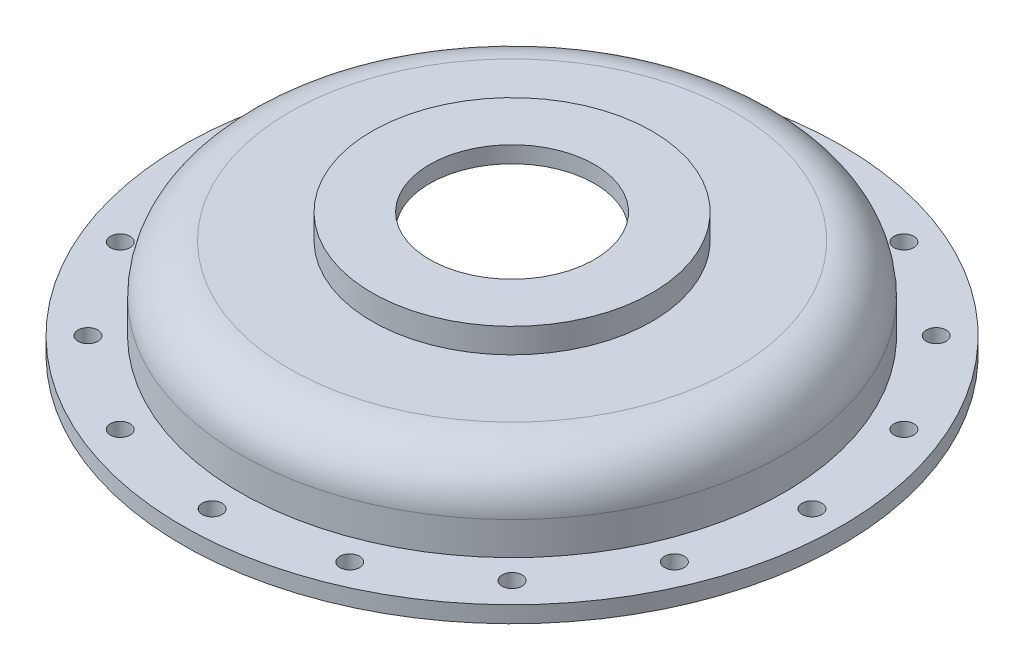
from build123d import *

# Parameters (mm, degrees)
SKETCH2_R          = 6
CUT_EXTRUDE8_DEPTH = 291.215437219
CIRPATTERN1_COUNT  = 16


with BuildPart() as part:
    # Sketch1 → Revolve2 (revolve)
    with BuildSketch(Plane.XY, mode=Mode.PRIVATE) as revolve2_sk:
        with BuildLine():
            Line((-200, 10), (-165, 10))
            Line((-165, 10), (-165, 30))
            ThreePointArc((-165, 30), (-156.213203436, 51.213203436), (-135, 60))
            Line((-135, 60), (-85, 60))
            Line((-85, 60), (-85, 75))
            Line((-85, 75), (-50, 75))
            Line((-50, 75), (-50, 65))
            Line((-50, 65), (-75, 65))
            Line((-75, 65), (-75, 50))
            Line((-75, 50), (-135, 50))
            ThreePointArc((-135, 50), (-149.142135624, 44.142135624), (-155, 30))
            Line((-155, 30), (-155, 0))
            Line((-155, 0), (-200, 0))
            Line((-200, 0), (-200, 10))
        make_face()
    revolve(revolve2_sk.sketch.rotate(Axis((0, 0, 0), (0, 1, 0)), 270), axis=Axis((0, 0, 0), (0, 1, 0)))

    # Sketch2 → Cut-Extrude8 (cut, through all)
    with BuildSketch(Plane(origin=(0, 10, 0), x_dir=(1, 0, 0), z_dir=(0, 1, 0))):
        with Locations(Location((0, 182, 0), (0, 0, 270))):
            Circle(SKETCH2_R)
    cut_extrude8 = extrude(amount=-CUT_EXTRUDE8_DEPTH, mode=Mode.SUBTRACT)

    # CirPattern1: Cut-Extrude8 ×16 about axis
    cirpattern1_axis = Axis((0, 0, 0), (0, 1, 0))
    for i in range(1, CIRPATTERN1_COUNT):
        add(cut_extrude8.rotate(cirpattern1_axis, i * 360 / CIRPATTERN1_COUNT), mode=Mode.SUBTRACT)


solid = part.part
